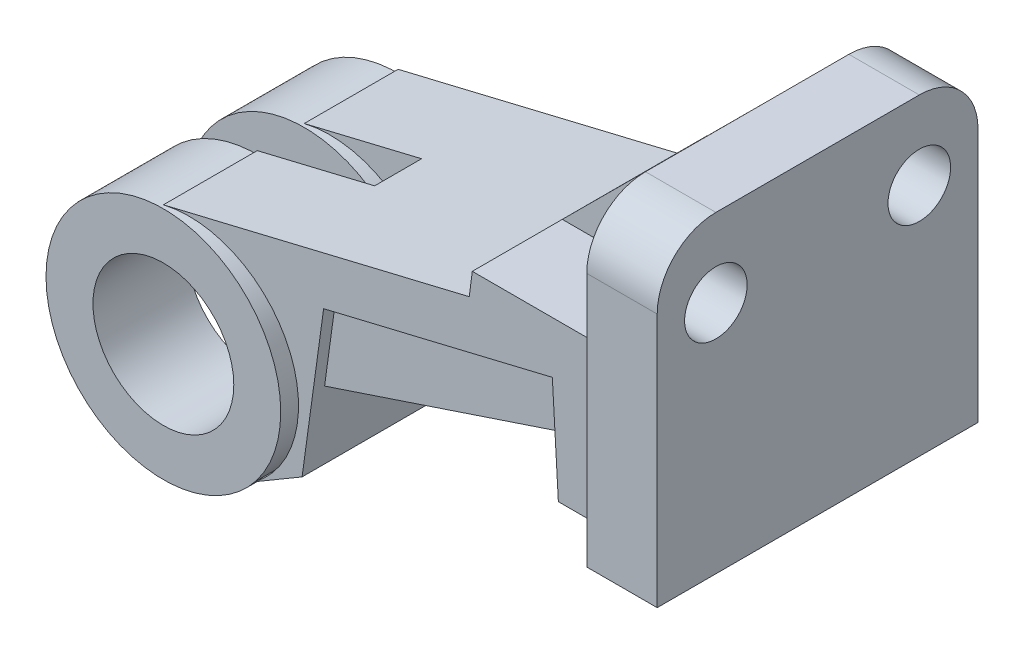
from build123d import *

# Parameters (mm, degrees)
BOSS_EXTRUDE1_DEPTH   = 60
SKETCH1_R             = 30
SKETCH1_R_2           = 18
BOSS_EXTRUDE1_2_DEPTH = 60
SKETCH2_W             = 82
SKETCH2_H             = 80
BOSS_EXTRUDE2_DEPTH   = 18
FILLET1_R             = 15
BOSS_EXTRUDE3_DEPTH   = 6
SKETCH4_W             = 12
SKETCH4_H             = 81.808437473
CUT_EXTRUDE1_DEPTH    = 62
SKETCH9_R             = 8
CUT_EXTRUDE2_DEPTH    = 32
BOSS_EXTRUDE4_DEPTH   = 26


with BuildPart() as part:
    # Sketch1 → Boss-Extrude1 (new body)
    with BuildSketch(Plane.XY):
        with BuildLine():
            Line((78.188542599, 49.614870773), (0, 30.851716638))
            ThreePointArc((0, 30.851716638), (31.852594073, 15.597634824), (23.453928376, -18.705968131))
            Line((23.453928376, -18.705968131), (35.453928376, -11.659038808))
            Line((35.453928376, -11.659038808), (40.962622254, 28.340961192))
            Line((40.962622254, 28.340961192), (99.418852734, 42.368889405))
            Line((99.418852734, 42.368889405), (100.962622254, 15.614870773))
            Line((100.962622254, 15.614870773), (118.962622254, 15.614870773))
            Line((118.962622254, 15.614870773), (118.962622254, 55.614870773))
            Line((118.962622254, 55.614870773), (78.962622254, 55.614870773))
            Line((78.962622254, 55.614870773), (78.188542599, 49.614870773))
        make_face()
    extrude(amount=-BOSS_EXTRUDE1_DEPTH)

    # Sketch3 → Boss-Extrude3 (add, symmetric)
    with BuildSketch(Plane.XY.offset(-29)):
        Polygon((119, 95.5609912), (78.962622254, 55.614870773), (118.962622254, 55.614870773), align=None)
    extrude(amount=BOSS_EXTRUDE3_DEPTH, both=True)


with BuildPart() as body_2:
    # Sketch1 → Boss-Extrude1 2 (new body)
    with BuildSketch(Plane.XY):
        Circle(SKETCH1_R)
        Circle(SKETCH1_R_2, mode=Mode.SUBTRACT)
    extrude(amount=-BOSS_EXTRUDE1_2_DEPTH)


with BuildPart() as body_3:
    # Sketch2 → Boss-Extrude2 (new body)
    with BuildSketch(Plane(origin=(119, 0, 0), x_dir=(0, 0, -1), z_dir=(1, 0, 0))):
        with Locations((30.224366482, 55.5609912)):
            Rectangle(SKETCH2_W, SKETCH2_H)
    extrude(amount=BOSS_EXTRUDE2_DEPTH)

    # Fillet1
    fillet1_edges = [body_3.edges().sort_by_distance(p)[0] for p in [
        (128, 95.5609912, 10.775633518),
        (128, 95.5609912, -71.224366482),
    ]]
    fillet(fillet1_edges, radius=FILLET1_R)

    # Sketch9 → Cut-Extrude2 (cut)
    with BuildSketch(Plane.ZY.offset(-119)):
        with Locations((-56.224366482, 75.5609912)):
            Circle(SKETCH9_R)
        with Locations((-4.224366482, 75.5609912)):
            Circle(SKETCH9_R)
    extrude(amount=-CUT_EXTRUDE2_DEPTH, mode=Mode.SUBTRACT)


with BuildPart() as cut_extrude1_tool:
    # Sketch4 → Cut-Extrude1 (new body)
    with BuildSketch(Plane.ZY.offset(-30)):
        with Locations((-30, 5.781361386)):
            Rectangle(SKETCH4_W, SKETCH4_H)
    extrude(amount=CUT_EXTRUDE1_DEPTH)


with BuildPart() as part_1:
    add(part.part)

    # Cut-Extrude1: cut by cut_extrude1_tool
    add(cut_extrude1_tool.part, mode=Mode.SUBTRACT)

    # Sketch10 → Boss-Extrude4 (add, symmetric)
    with BuildSketch(Plane.XY.offset(-29)):
        Polygon((38.208275315, 8.340961192), (100.190737494, 28.991880089), (99.418852734, 42.368889405), (40.962622254, 28.340961192), align=None)
    extrude(amount=BOSS_EXTRUDE4_DEPTH, both=True)


with BuildPart() as body_2_1:
    add(body_2.part)

    # Cut-Extrude1: cut by cut_extrude1_tool
    add(cut_extrude1_tool.part, mode=Mode.SUBTRACT)


solid = Compound([body_3.part, part_1.part, body_2_1.part])
